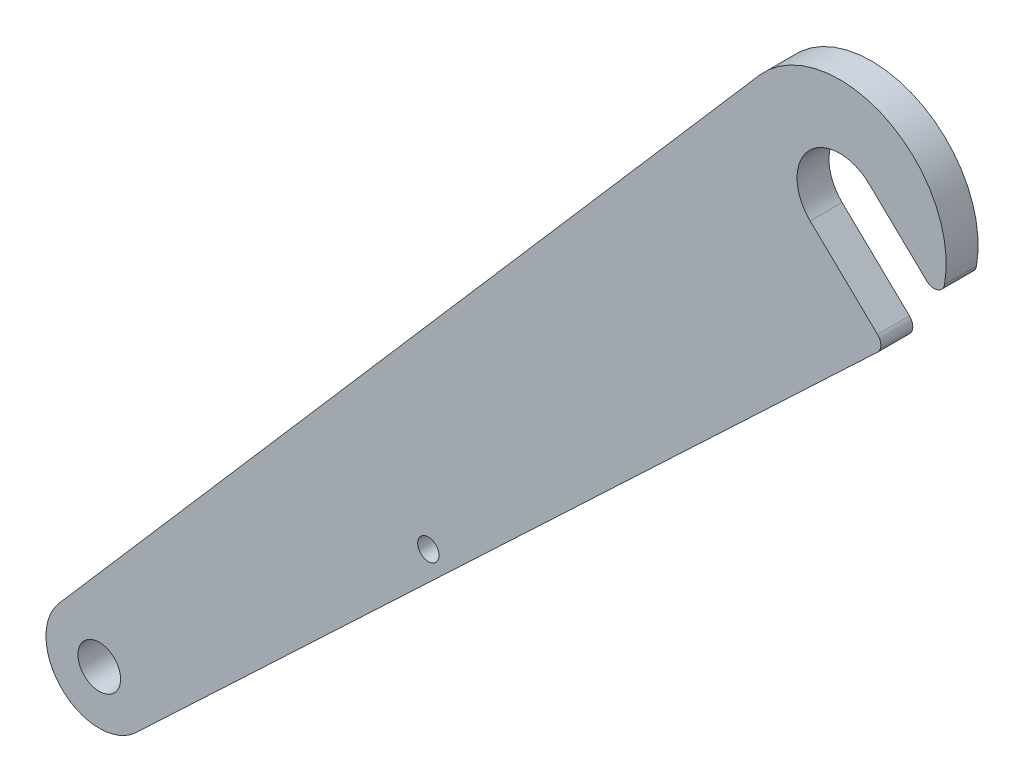
from build123d import *

# Parameters (mm, degrees)
SKETCH_1_R      = 2
SKETCH_1_R_2    = 1
EXTRUDE_1_DEPTH = 3
FILLET_1_R      = 1


with BuildPart() as part:
    # 草图1 → 凸台-拉伸1 (new body)
    with BuildSketch(Plane.XY):
        with BuildLine():
            Line((66.731946056, 69.612461713), (73.815819619, 62.821713952))
            Line((73.815819619, 62.821713952), (3.432687046, -3.63547241))
            ThreePointArc((3.432687046, -3.63547241), (-3.460067431, -3.609422859), (-3.777206949, 3.276081144))
            Line((-3.777206949, 3.276081144), (61.945586102, 79.052162289))
            ThreePointArc((61.945586102, 79.052162289), (74.586475775, 81.109748207), (78.884235331, 69.045129923))
            Line((78.884235331, 69.045129923), (72.268053944, 75.387538287))
            ThreePointArc((72.268053944, 75.387538287), (66.612461713, 75.268053944), (66.731946056, 69.612461713))
        make_face()
        Circle(SKETCH_1_R, mode=Mode.SUBTRACT)
        with Locations((30.891832327, 25)):
            Circle(SKETCH_1_R_2, mode=Mode.SUBTRACT)
    extrude(amount=EXTRUDE_1_DEPTH)

    # 圆角1
    fillet_1_edges = [part.edges().sort_by_distance(p)[0] for p in [
        (73.815819619, 62.821713952, 1.5),
        (78.884235331, 69.045129923, 1.5),
    ]]
    fillet(fillet_1_edges, radius=FILLET_1_R)


solid = part.part
